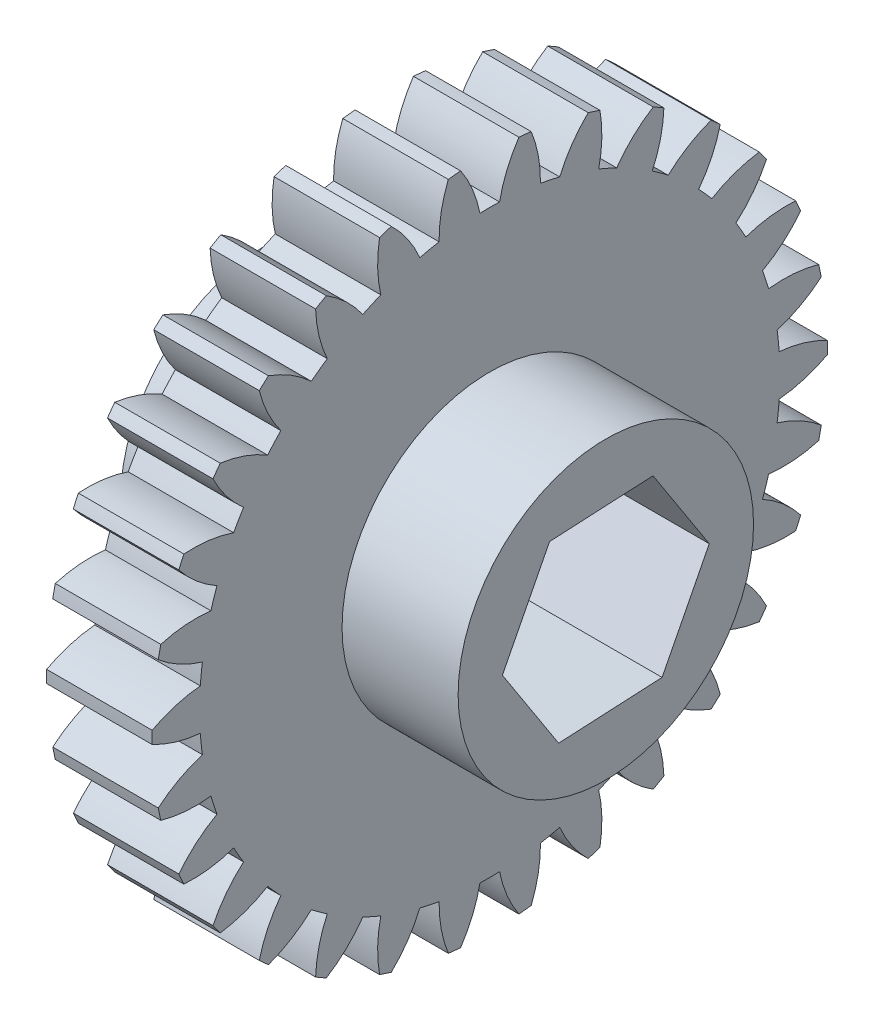
from build123d import *

# Parameters (mm, degrees)
BASPROSKE_W        = 5
BASPROSKE_H        = 16
TOOTHCUT_DEPTH     = 24.173260453
TEETHCUTS_COUNT    = 30
TEETHCUTS_ANGLE    = 348
HUBNEABOTSKE_R     = 7
HUBNEARBOTH_DEPTH  = 5.5000254
HUBFAR_START       = 5.5000254
HUBFARSKE_R        = 7
HUBFAR_DEPTH       = 5.5000254
BORSKE_R           = 1
BORE_DEPTH         = 16.0000508
CUT_EXTRUDE1_DEPTH = 28.678405283


with BuildPart() as part:
    # BasProSke → Base-Revolve (revolve)
    with BuildSketch(Plane(origin=(0, 0, 0), x_dir=(1, 0, 0), z_dir=(0, 1, 0)), mode=Mode.PRIVATE) as base_revolve_sk:
        with Locations((2.5, 8)):
            Rectangle(BASPROSKE_W, BASPROSKE_H)
    revolve(base_revolve_sk.sketch.rotate(Axis((-10, 0, 0), (1, 0, 0)), 180), axis=Axis((-10, 0, 0), (1, 0, 0)))

    # TooCutSke → ToothCut (cut, through all)
    with BuildSketch(Plane(origin=(0, 0, 0), x_dir=(0, 0, -1), z_dir=(1, 0, 0))):
        with BuildLine():
            ThreePointArc((0.466400716, 13.741086979), (0, 13.749), (-0.466400716, 13.741086979))
            ThreePointArc((-0.466400716, 13.741086979), (-0.819142092, 14.899954875), (-1.3974676, 15.964351834))
            ThreePointArc((-1.3974676, 15.964351834), (0, 16.0254), (1.3974676, 15.964351834))
            ThreePointArc((1.3974676, 15.964351834), (0.819142092, 14.899954875), (0.466400716, 13.741086979))
        make_face()
    toothcut = extrude(amount=TOOTHCUT_DEPTH, mode=Mode.SUBTRACT)

    # TeethCuts: ToothCut ×30 about axis
    teethcuts_axis = Axis((-10, 0, 0), (1, 0, 0))
    for i in range(1, TEETHCUTS_COUNT):
        add(toothcut.rotate(teethcuts_axis, i * TEETHCUTS_ANGLE / (TEETHCUTS_COUNT - 1)), mode=Mode.SUBTRACT)

    # HubNeaBotSke → HubNearBoth (add)
    with BuildSketch(Plane.ZY):
        with Locations(Location((0, 0, 0), (0, 0, 180))):
            Circle(HUBNEABOTSKE_R)
    extrude(amount=HUBNEARBOTH_DEPTH)

    # HubFarSke → HubFar (add)
    with BuildSketch(Plane(origin=(5, 0, 0), x_dir=(0, 0, -1), z_dir=(1, 0, 0)).offset(HUBFAR_START)):
        Circle(HUBFARSKE_R)
    extrude(amount=-HUBFAR_DEPTH)

    # BorSke → Bore (cut, symmetric)
    with BuildSketch(Plane(origin=(0, 0, 0), x_dir=(0, 0, -1), z_dir=(1, 0, 0))):
        with Locations(Location((0, 0, 0), (0, 0, 180))):
            Circle(BORSKE_R)
    extrude(amount=BORE_DEPTH, both=True, mode=Mode.SUBTRACT)

    # Sketch2 → Cut-Extrude1 (cut, through all)
    with BuildSketch(Plane(origin=(10.5000254, 0, 0), x_dir=(0, 0, -1), z_dir=(1, 0, 0))):
        Polygon((2.235526404, 4.368724646), (-2.665663324, 4.120384979), (-4.901189727, -0.248339666), (-2.235526404, -4.368724646), (2.665663324, -4.120384979), (4.901189727, 0.248339666), align=None)
    extrude(amount=-CUT_EXTRUDE1_DEPTH, mode=Mode.SUBTRACT)


solid = part.part
